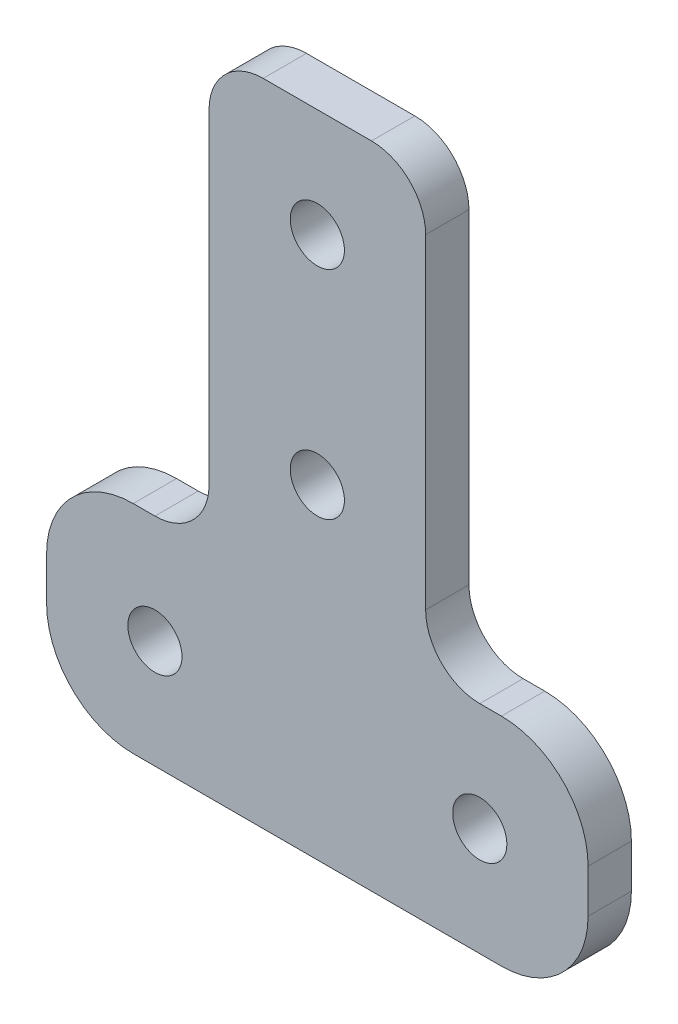
from build123d import *

# Parameters (mm, degrees)
SKETCH1_R           = 2.5
BOSS_EXTRUDE1_DEPTH = 4
FILLET1_R           = 5
FILLET2_R           = 8


with BuildPart() as part:
    # Sketch1 → Boss-Extrude1 (new body)
    with BuildSketch(Plane.XY):
        Polygon((-10, 60), (10, 60), (10, 20), (25, 20), (25, 0), (-25, 0), (-25, 20), (-10, 20), align=None)
        with Locations((0, 50)):
            Circle(SKETCH1_R, mode=Mode.SUBTRACT)
        with Locations((0, 30)):
            Circle(SKETCH1_R, mode=Mode.SUBTRACT)
        with Locations((15, 10)):
            Circle(SKETCH1_R, mode=Mode.SUBTRACT)
        with Locations((-15, 10)):
            Circle(SKETCH1_R, mode=Mode.SUBTRACT)
    extrude(amount=BOSS_EXTRUDE1_DEPTH)

    # Fillet1
    fillet1_edges = [part.edges().sort_by_distance(p)[0] for p in [
        (-10, 20, 2),
        (-10, 60, 2),
        (10, 60, 2),
        (10, 20, 2),
    ]]
    fillet(fillet1_edges, radius=FILLET1_R)

    # Fillet2
    fillet2_edges = [part.edges().sort_by_distance(p)[0] for p in [
        (25, 0, 2),
        (-25, 0, 2),
        (-25, 20, 2),
        (25, 20, 2),
    ]]
    fillet(fillet2_edges, radius=FILLET2_R)


solid = part.part
